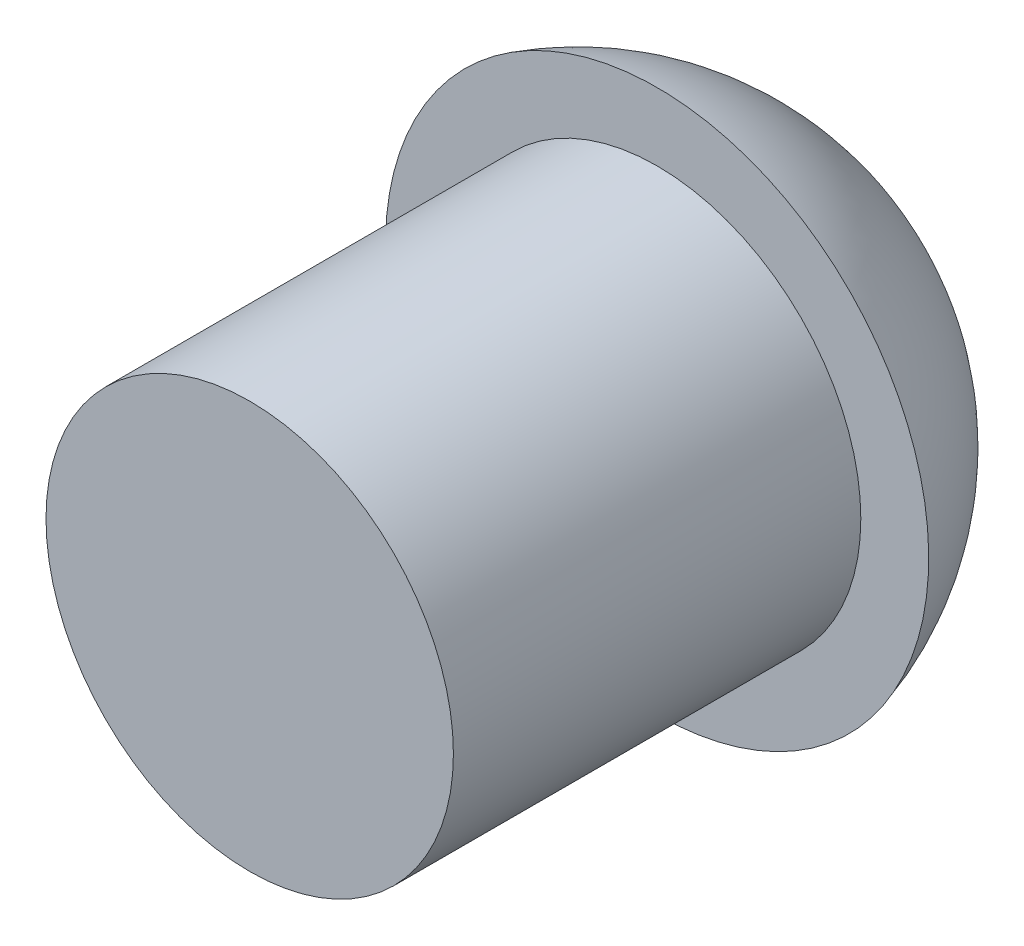
from build123d import *

# Parameters (mm, degrees)
SKETCH1_R           = 3
BOSS_EXTRUDE1_DEPTH = 6
CUT_EXTRUDE1_DEPTH  = 1


with BuildPart() as part:
    # Sketch1 → Boss-Extrude1 (new body)
    with BuildSketch(Plane.XY):
        Circle(SKETCH1_R)
    extrude(amount=BOSS_EXTRUDE1_DEPTH)

    # Sketch4 → Revolve1 (revolve)
    with BuildSketch(Plane.ZY, mode=Mode.PRIVATE) as revolve1_sk:
        with BuildLine():
            Line((0, -4), (0, 0))
            Line((0, 0), (-3, 0))
            ThreePointArc((-3, 0), (-2.166666667, -2.5), (0, -4))
        make_face()
    revolve(revolve1_sk.sketch.rotate(Axis((0, 0, 0), (0, 0, -1)), 180), axis=Axis((0, 0, 0), (0, 0, -1)))

    # Sketch5 → Cut-Extrude1 (cut)
    with BuildSketch(Plane.XY.offset(-3)):
        Polygon((0, 1.811201152), (1.414213562, 0.396987589), (0.664213562, 0.396987589), (0.664213562, -1.603012411), (-0.664213562, -1.603012411), (-0.664213562, 0.396987589), (-1.414213562, 0.396987589), align=None)
    extrude(amount=CUT_EXTRUDE1_DEPTH, mode=Mode.SUBTRACT)


solid = part.part
